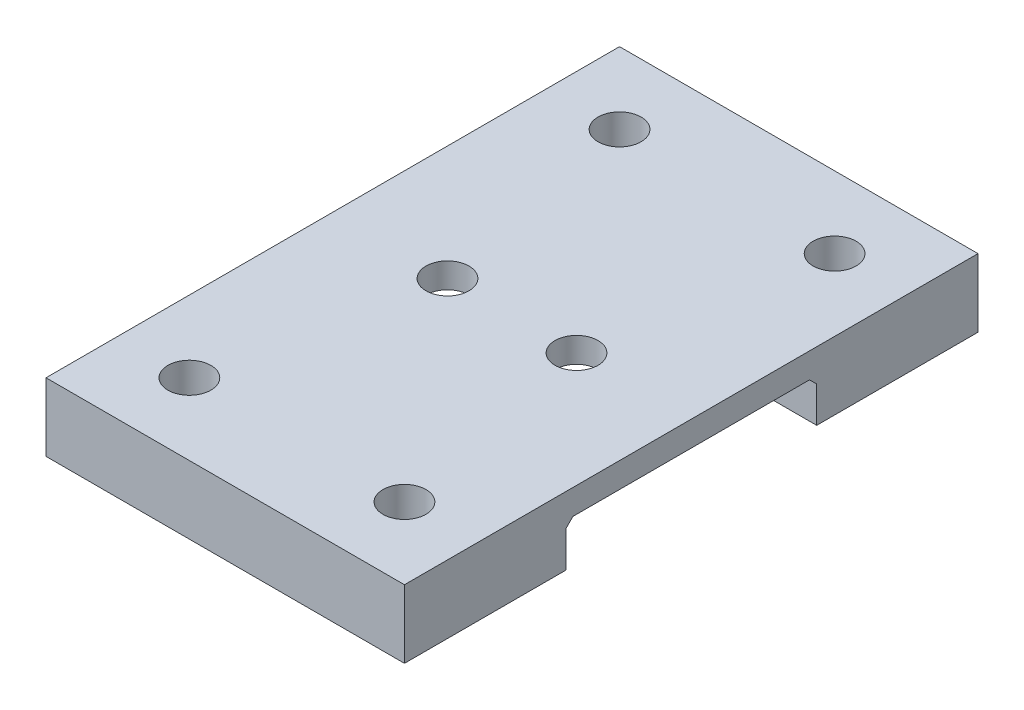
from build123d import *

# Parameters (mm, degrees)
SKETCH1_W           = 50
SKETCH1_H           = 80
SKETCH1_R           = 3
BOSS_EXTRUDE1_DEPTH = 9.5
SKETCH2_W           = 80.10102192
SKETCH2_H           = 35
CUT_EXTRUDE1_DEPTH  = 6
SKETCH3_R           = 3
CUT_EXTRUDE2_DEPTH  = 48.549973712
CHAMFER1_SIZE       = 1


with BuildPart() as part:
    # Sketch1 → Boss-Extrude1 (new body)
    with BuildSketch(Plane(origin=(0, 0, 0), x_dir=(1, 0, 0), z_dir=(0, 1, 0))):
        Rectangle(SKETCH1_W, SKETCH1_H)
        with Locations(Location((-15, 30, 0), (0, 0, 270))):
            Circle(SKETCH1_R, mode=Mode.SUBTRACT)
        with Locations(Location((15, 30, 0), (0, 0, 90))):
            Circle(SKETCH1_R, mode=Mode.SUBTRACT)
        with Locations(Location((-15, -30, 0), (0, 0, 90))):
            Circle(SKETCH1_R, mode=Mode.SUBTRACT)
        with Locations(Location((15, -30, 0), (0, 0, 270))):
            Circle(SKETCH1_R, mode=Mode.SUBTRACT)
    extrude(amount=BOSS_EXTRUDE1_DEPTH)

    # Sketch2 → Cut-Extrude1 (cut)
    with BuildSketch(Plane.XZ):
        Rectangle(SKETCH2_W, SKETCH2_H)
    extrude(amount=-CUT_EXTRUDE1_DEPTH, mode=Mode.SUBTRACT)

    # Sketch3 → Cut-Extrude2 (cut, through all)
    with BuildSketch(Plane.XZ.offset(-6)):
        with Locations(Location((-9, 0, 0), (0, 0, 270))):
            Circle(SKETCH3_R)
        with Locations(Location((9, 0, 0), (0, 0, 270))):
            Circle(SKETCH3_R)
    extrude(amount=-CUT_EXTRUDE2_DEPTH, mode=Mode.SUBTRACT)

    # Chamfer1
    chamfer1_edges = [part.edges().sort_by_distance(p)[0] for p in [
        (0, 6, -17.5),
        (0, 6, 17.5),
    ]]
    chamfer(chamfer1_edges, length=CHAMFER1_SIZE)


solid = part.part
